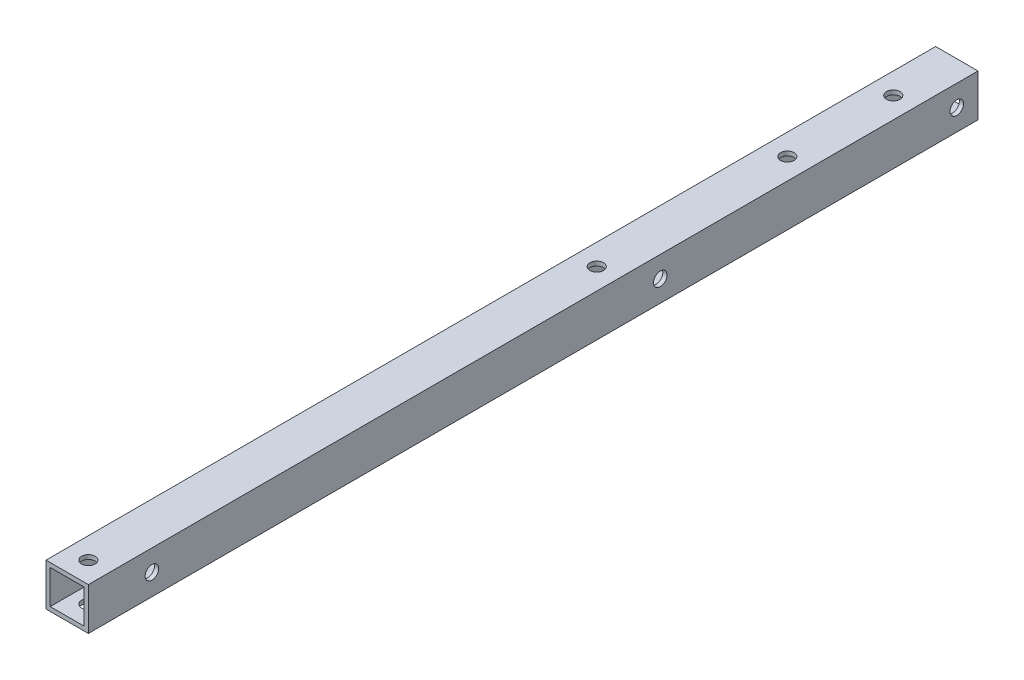
from build123d import *

# Parameters (mm, degrees)
SKETCH_1_W          = 10
SKETCH_1_H          = 10
SKETCH_1_W_2        = 8
SKETCH_1_H_2        = 8
EXTRUDE_1_DEPTH     = 210
SKETCH_2_R          = 1.6
CUT_EXTRUDE_1_DEPTH = 211.297408448
SKETCH_3_R          = 1.6
CUT_EXTRUDE_2_DEPTH = 211.297408448
SKETCH_4_R          = 1.6
CUT_EXTRUDE_3_DEPTH = 211.297408448


with BuildPart() as part:
    # ｽｹｯﾁ1 → ﾎﾞｽ - 押し出し1 (new body)
    with BuildSketch(Plane.XY):
        Rectangle(SKETCH_1_W, SKETCH_1_H)
        Rectangle(SKETCH_1_W_2, SKETCH_1_H_2, mode=Mode.SUBTRACT)
    extrude(amount=EXTRUDE_1_DEPTH)

    # ｽｹｯﾁ2 → ｶｯﾄ - 押し出し1 (cut, through all)
    with BuildSketch(Plane.ZY.offset(5)):
        with Locations(Location((5, 0, 0), (0, 0, 270))):
            Circle(SKETCH_2_R)
        with Locations(Location((75, 0, 0), (0, 0, 270))):
            Circle(SKETCH_2_R)
        with Locations(Location((195, 0, 0), (0, 0, 270))):
            Circle(SKETCH_2_R)
    extrude(amount=-CUT_EXTRUDE_1_DEPTH, mode=Mode.SUBTRACT)

    # ｽｹｯﾁ3 → ｶｯﾄ - 押し出し2 (cut, through all)
    with BuildSketch(Plane(origin=(0, 5, 0), x_dir=(1, 0, 0), z_dir=(0, 1, 0))):
        with Locations(Location((0, -15, 0), (0, 0, 270))):
            Circle(SKETCH_3_R)
        with Locations(Location((0, -85, 0), (0, 0, 270))):
            Circle(SKETCH_3_R)
        with Locations(Location((0, -40, 0), (0, 0, 270))):
            Circle(SKETCH_3_R)
    extrude(amount=-CUT_EXTRUDE_2_DEPTH, mode=Mode.SUBTRACT)

    # ｽｹｯﾁ4 → ｶｯﾄ - 押し出し3 (cut, through all)
    with BuildSketch(Plane(origin=(0, 5, 0), x_dir=(1, 0, 0), z_dir=(0, 1, 0))):
        with Locations(Location((0, -205, 0), (0, 0, 270))):
            Circle(SKETCH_4_R)
    extrude(amount=-CUT_EXTRUDE_3_DEPTH, mode=Mode.SUBTRACT)


solid = part.part
